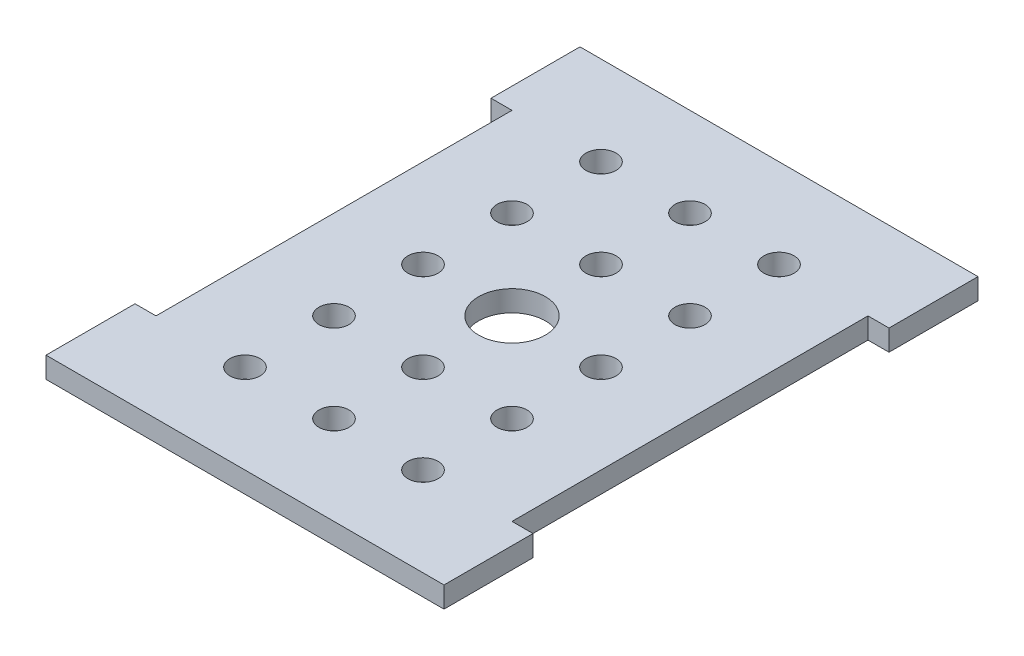
from build123d import *

# Parameters (mm, degrees)
SKETCH1_W                 = 50.8
SKETCH1_H                 = 76.2
BOSS_EXTRUDE1_DEPTH       = 2.9972
SKETCH2_W                 = 2.9972
SKETCH2_H                 = 12.7
BOSS_EXTRUDE2_DEPTH       = 2.9972
F_8_CLEARANCE_HOLE1_D     = 4.3053
F_8_CLEARANCE_HOLE1_DEPTH = 6.351016
SKETCH6_R                 = 4.7625
CUT_EXTRUDE1_DEPTH        = 48.612962265


with BuildPart() as part:
    # Sketch1 → Boss-Extrude1 (new body)
    with BuildSketch(Plane(origin=(0, 0, 0), x_dir=(1, 0, 0), z_dir=(0, 1, 0))):
        Rectangle(SKETCH1_W, SKETCH1_H)
    extrude(amount=BOSS_EXTRUDE1_DEPTH)

    # Sketch2 → Boss-Extrude2 (add)
    with BuildSketch(Plane(origin=(0, 2.9972, 0), x_dir=(1, 0, 0), z_dir=(0, 1, 0))):
        with Locations((26.8986, 31.75)):
            Rectangle(SKETCH2_W, SKETCH2_H)
        with Locations((26.8986, -31.75)):
            Rectangle(SKETCH2_W, SKETCH2_H)
        with Locations((-26.8986, -31.75)):
            Rectangle(SKETCH2_W, SKETCH2_H)
        with Locations((-26.8986, 31.75)):
            Rectangle(SKETCH2_W, SKETCH2_H)
    extrude(amount=-BOSS_EXTRUDE2_DEPTH)

    # #8 Clearance Hole1
    with Locations(Plane(origin=(0, 2.9972, 0), x_dir=(1, 0, 0), z_dir=(0, 1, 0))):
        with Locations((12.7, -25.4), (0, -25.4), (-12.7, -25.4), (-12.7, -12.7), (0, -12.7), (12.7, -12.7), (-12.7, 0), (0, 0), (12.7, 0), (12.7, 12.7), (0, 12.7), (-12.7, 12.7), (-12.7, 25.4), (0, 25.4), (12.7, 25.4)):
            Hole(F_8_CLEARANCE_HOLE1_D / 2, depth=F_8_CLEARANCE_HOLE1_DEPTH)

    # Sketch6 → Cut-Extrude1 (cut, through all)
    with BuildSketch(Plane(origin=(0, 2.9972, 0), x_dir=(1, 0, 0), z_dir=(0, 1, 0))):
        with Locations(Location((0, 0, 0), (0, 0, 270))):
            Circle(SKETCH6_R)
    extrude(amount=-CUT_EXTRUDE1_DEPTH, mode=Mode.SUBTRACT)


solid = part.part
